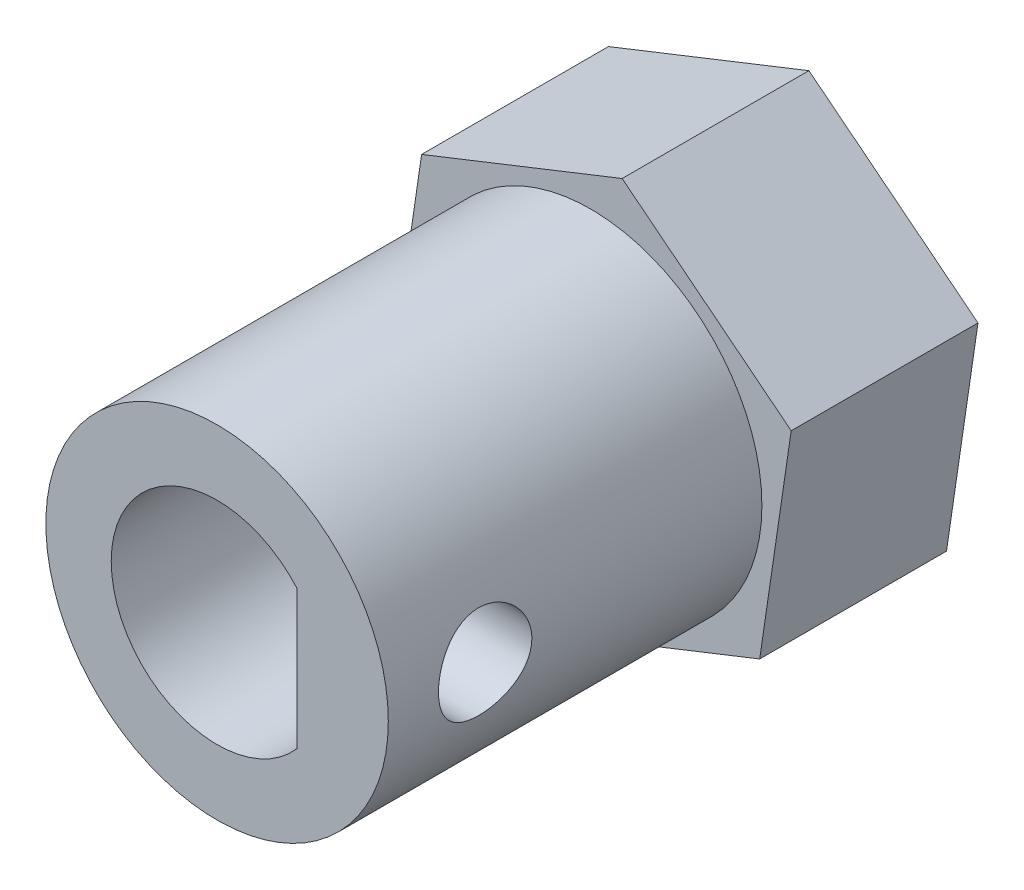
from build123d import *

# Parameters (mm, degrees)
EXTRUDE_1_DEPTH     = 6
SKETCH_2_R          = 5.5
EXTRUDE_2_DEPTH     = 12
SKETCH_3_R          = 1.6
CUT_EXTRUDE_1_DEPTH = 6
CUT_EXTRUDE_2_DEPTH = 12
SKETCH_5_R          = 1.5
CUT_EXTRUDE_3_DEPTH = 10
CUT_EXTRUDE_4_DEPTH = 12


with BuildPart() as part:
    # 草图1 → 凸台-拉伸1 (new body)
    with BuildSketch(Plane.XY):
        Polygon((5.429941256, -4.302991745), (6.441470791, 2.550971196), (1.011529536, 6.853962941), (-5.429941256, 4.302991745), (-6.441470791, -2.550971196), (-1.011529536, -6.853962941), align=None)
    extrude(amount=EXTRUDE_1_DEPTH)

    # 草图2 → 凸台-拉伸2 (add)
    with BuildSketch(Plane.XY.offset(6)):
        Circle(SKETCH_2_R)
    extrude(amount=EXTRUDE_2_DEPTH)

    # 草图3 → 切除-拉伸1 (cut)
    with BuildSketch(Plane(origin=(0, 0, 0), x_dir=(-1, 0, 0), z_dir=(0, 0, -1))):
        Circle(SKETCH_3_R)
    extrude(amount=-CUT_EXTRUDE_1_DEPTH, mode=Mode.SUBTRACT)

    # 草图4 → 切除-拉伸2 (cut)
    with BuildSketch(Plane.XY.offset(18)):
        with BuildLine():
            Line((2.45, 1.731328969), (2.45, -1.731328969))
            ThreePointArc((2.45, -1.731328969), (-3, 0), (2.45, 1.731328969))
        make_face()
    extrude(amount=-CUT_EXTRUDE_2_DEPTH, mode=Mode.SUBTRACT)

    # 草图5 → 切除-拉伸3 (cut)
    with BuildSketch(Plane.ZY.offset(-2.45)):
        with Locations(Location((14.888016114, 0, 0), (0, 0, 270))):
            Circle(SKETCH_5_R)
    extrude(amount=-CUT_EXTRUDE_3_DEPTH, mode=Mode.SUBTRACT)

    # 草图6 → 切除-拉伸4 (cut)
    with BuildSketch(Plane.XY.offset(18)):
        with BuildLine():
            Line((2.569146545, 2.226990352), (2.569146545, -2.226990352))
            ThreePointArc((2.569146545, -2.226990352), (-3.4, 0), (2.569146545, 2.226990352))
        make_face()
    extrude(amount=-CUT_EXTRUDE_4_DEPTH, mode=Mode.SUBTRACT)


solid = part.part
